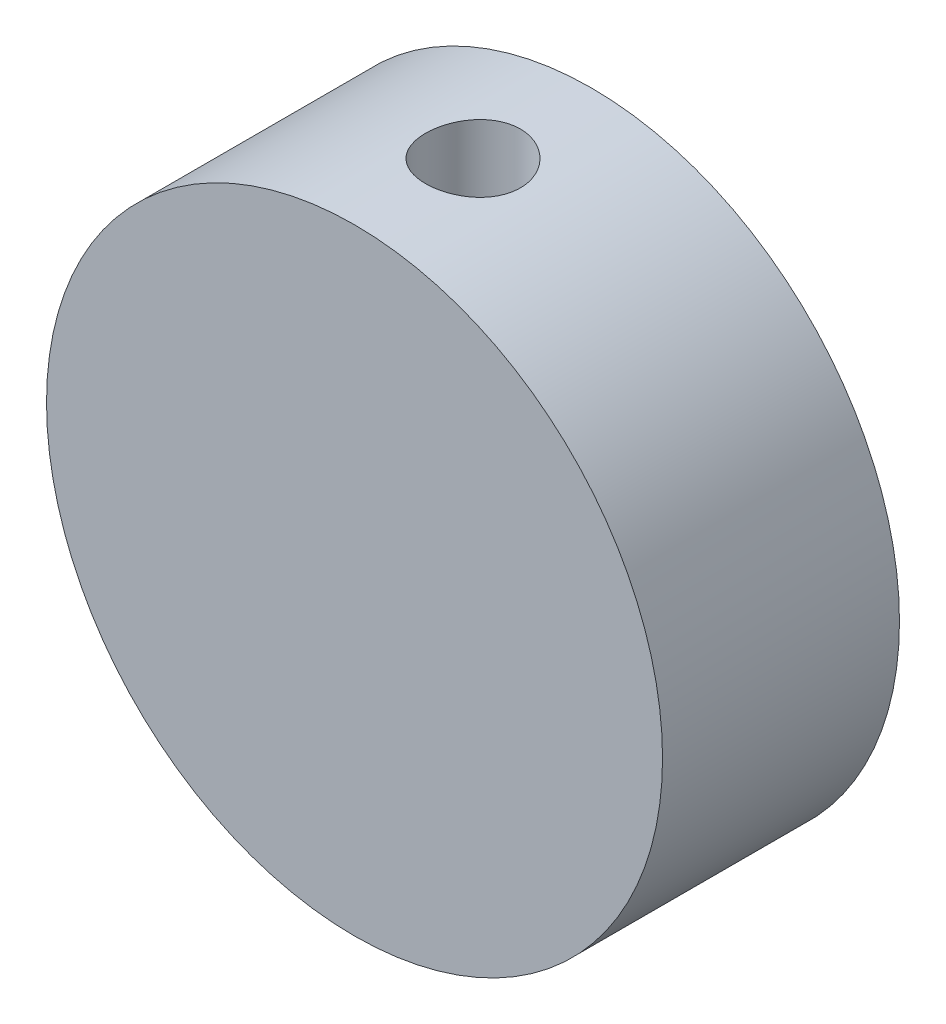
from build123d import *

# Parameters (mm, degrees)
PROFILE_OUTER_R          = 26
FEATURE_CYLINDER_DEPTH   = 10
PROFILE_BORE_R           = 4
FEATURE_CROSS_BORE_DEPTH = 40


with BuildPart() as part:
    # profile:outer → feature:cylinder (new, symmetric)
    with BuildSketch(Plane.XY):
        Circle(PROFILE_OUTER_R)
    extrude(amount=FEATURE_CYLINDER_DEPTH, both=True)

    # profile:bore → feature:cross-bore (cut, symmetric)
    with BuildSketch(Plane(origin=(0, 0, 0), x_dir=(1, 0, 0), z_dir=(0, 1, 0))):
        with Locations(Location((0, 0, 0), (0, 0, 90))):
            Circle(PROFILE_BORE_R)
    extrude(amount=FEATURE_CROSS_BORE_DEPTH, both=True, mode=Mode.SUBTRACT)


solid = part.part
